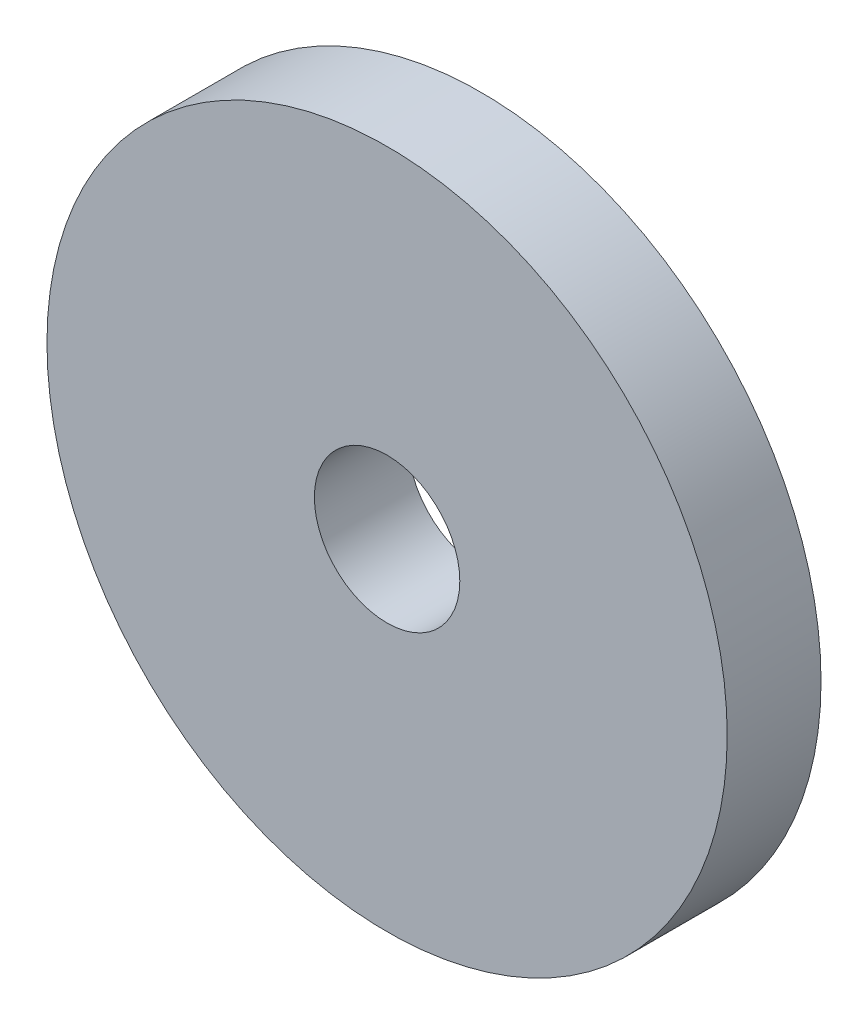
from build123d import *

# Parameters (mm, degrees)
SKETCH1_R           = 7.25
BOSS_EXTRUDE1_DEPTH = 2
SKETCH4_R           = 1.55
CUT_EXTRUDE4_DEPTH  = 4.5


with BuildPart() as part:
    # Sketch1 → Boss-Extrude1 (new body)
    with BuildSketch(Plane.XY):
        Circle(SKETCH1_R)
    extrude(amount=BOSS_EXTRUDE1_DEPTH)

    # Sketch4 → Cut-Extrude4 (cut)
    with BuildSketch(Plane(origin=(0, 0, 0), x_dir=(-1, 0, 0), z_dir=(0, 0, -1))):
        Circle(SKETCH4_R)
    extrude(amount=-CUT_EXTRUDE4_DEPTH, mode=Mode.SUBTRACT)


solid = part.part
